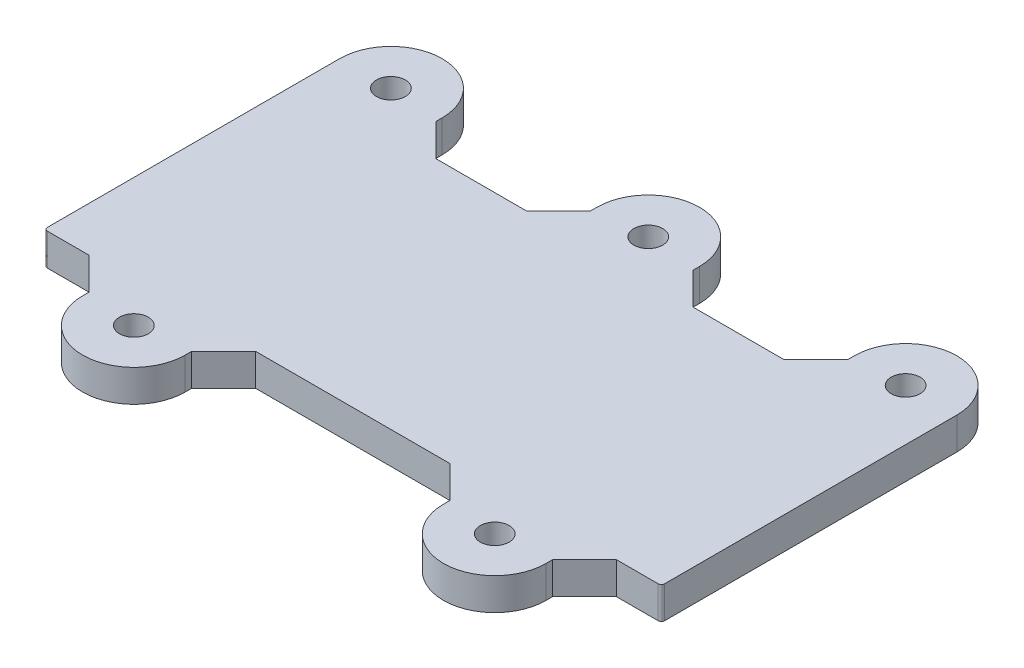
from build123d import *

# Parameters (mm, degrees)
BOSS_EXTRUDE1_DEPTH  = 5
CHAMFER1_SIZE        = 5
M4_CLEARANCE_HOLE1_D = 4.5
FILLET1_R            = 0.5


with BuildPart() as part:
    # Sketch1 → Boss-Extrude1 (new body)
    with BuildSketch(Plane(origin=(0, 0, 0), x_dir=(1, 0, 0), z_dir=(0, 1, 0))):
        with BuildLine():
            Line((48.15, -20.05), (48.15, 20.05))
            Line((48.15, 20.05), (48.15, 26.05))
            ThreePointArc((48.15, 26.05), (40.15, 34.05), (32.15, 26.05))
            Line((32.15, 26.05), (32.15, 20.05))
            Line((32.15, 20.05), (8, 20.05))
            Line((8, 20.05), (8, 26.05))
            ThreePointArc((8, 26.05), (0, 34.05), (-8, 26.05))
            Line((-8, 26.05), (-8, 20.05))
            Line((-8, 20.05), (-32.15, 20.05))
            Line((-32.15, 20.05), (-32.15, 26.05))
            ThreePointArc((-32.15, 26.05), (-40.15, 34.05), (-48.15, 26.05))
            Line((-48.15, 26.05), (-48.15, 20.05))
            Line((-48.15, 20.05), (-48.15, -20.05))
            Line((-48.15, -20.05), (-36.15, -20.05))
            Line((-36.15, -20.05), (-36.15, -26.05))
            ThreePointArc((-36.15, -26.05), (-28.15, -34.05), (-20.15, -26.05))
            Line((-20.15, -26.05), (-20.15, -20.05))
            Line((-20.15, -20.05), (20.15, -20.05))
            Line((20.15, -20.05), (20.15, -26.05))
            ThreePointArc((20.15, -26.05), (28.15, -34.05), (36.15, -26.05))
            Line((36.15, -26.05), (36.15, -20.05))
            Line((36.15, -20.05), (48.15, -20.05))
        make_face()
    extrude(amount=BOSS_EXTRUDE1_DEPTH)

    # Chamfer1
    chamfer1_edges = [part.edges().sort_by_distance(p)[0] for p in [
        (36.15, 2.5, 20.05),
        (20.15, 2.5, 20.05),
        (-20.15, 2.5, 20.05),
        (-36.15, 2.5, 20.05),
        (-32.15, 2.5, -20.05),
        (-8, 2.5, -20.05),
        (8, 2.5, -20.05),
        (32.15, 2.5, -20.05),
    ]]
    chamfer(chamfer1_edges, length=CHAMFER1_SIZE)

    # M4 Clearance Hole1 (through all)
    with Locations(Plane(origin=(28.15, 0, 26.05), x_dir=(0, 0, -1), z_dir=(0, -1, 0))):
        with Locations((0, 0), (52.1, -68.3), (52.1, -28.15), (52.1, 12), (0, -56.3)):
            Hole(M4_CLEARANCE_HOLE1_D / 2)

    # Fillet1
    fillet1_edges = [part.edges().sort_by_distance(p)[0] for p in [
        (-48.15, 2.5, 20.05),
        (48.15, 2.5, 20.05),
    ]]
    fillet(fillet1_edges, radius=FILLET1_R)


solid = part.part
